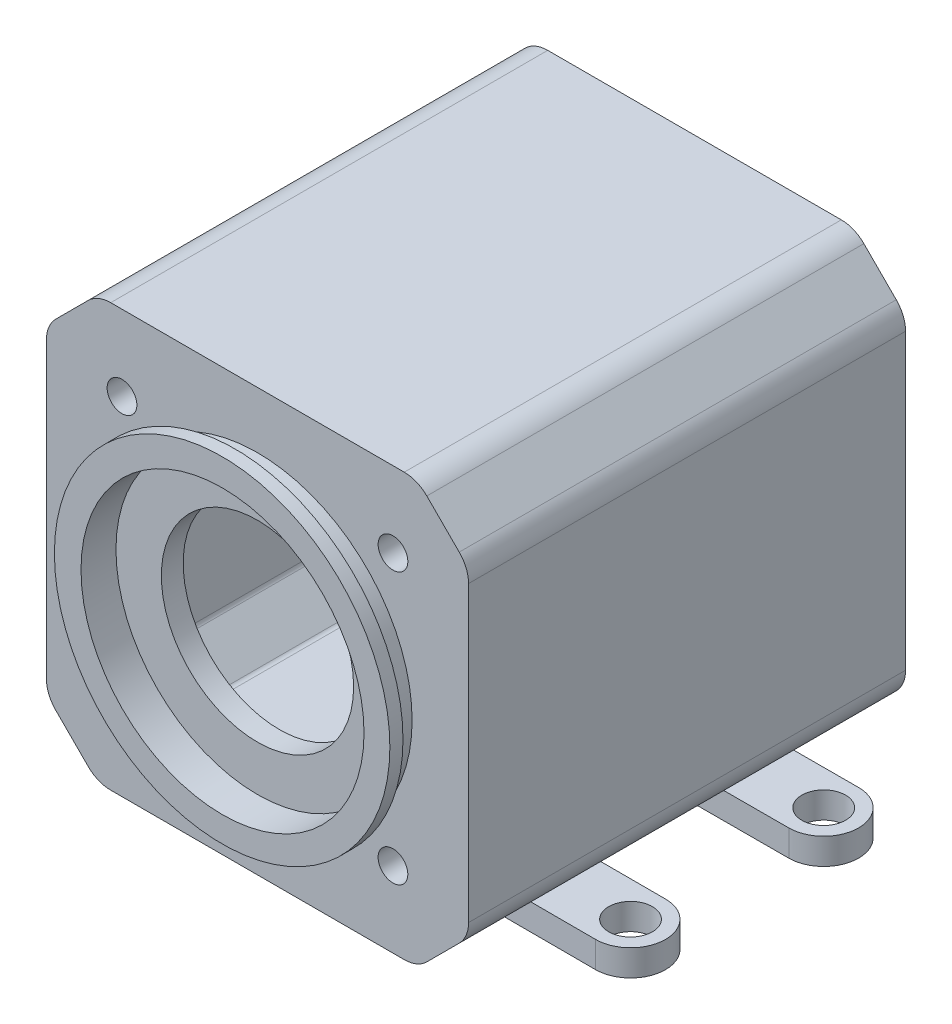
from build123d import *

# Parameters (mm, degrees)
SALIENTE_EXTRUIR3_DEPTH = 50
CROQUIS37_3_R           = 1.7
CROQUIS37_3_R_2         = 11
SALIENTE_EXTRUIR4_DEPTH = 2.5
CROQUIS38_R             = 17.69
CROQUIS38_R_2           = 16.19
SALIENTE_EXTRUIR5_DEPTH = 4
SALIENTE_EXTRUIR6_START = -1.5
CROQUIS40_R             = 19.19
CROQUIS40_R_2           = 17.69
SALIENTE_EXTRUIR6_DEPTH = 1.5
CROQUIS41_W             = 18.5
CROQUIS41_H             = 10.5
CORTAR_EXTRUIR1_DEPTH   = 11.5
SALIENTE_EXTRUIR7_DEPTH = 3
CROQUIS44_R             = 2.5
CORTAR_EXTRUIR2_DEPTH   = 3


with BuildPart() as part:
    # Croquis37 → Saliente-Extruir3 (new body)
    with BuildSketch(Plane.XY):
        with BuildLine():
            Line((-24.106917755, 16.707259035), (-24.106917755, -16.878527403))
            ThreePointArc((-24.106917755, -16.878527403), (-23.829078048, -18.275321931), (-23.037857506, -19.459467154))
            Line((-23.037857506, -19.459467154), (-19.330750725, -23.166573935))
            ThreePointArc((-19.330750725, -23.166573935), (-18.146605502, -23.957794478), (-16.749810974, -24.235634184))
            Line((-16.749810974, -24.235634184), (16.835975464, -24.235634184))
            ThreePointArc((16.835975464, -24.235634184), (18.232769992, -23.957794478), (19.416915215, -23.166573935))
            Line((19.416915215, -23.166573935), (23.124021997, -19.459467154))
            ThreePointArc((23.124021997, -19.459467154), (23.915242539, -18.275321931), (24.193082245, -16.878527403))
            Line((24.193082245, -16.878527403), (24.193082245, 16.707259035))
            ThreePointArc((24.193082245, 16.707259035), (23.915242539, 18.104053563), (23.124021997, 19.288198786))
            Line((23.124021997, 19.288198786), (19.416915215, 22.995305567))
            ThreePointArc((19.416915215, 22.995305567), (18.232769992, 23.78652611), (16.835975464, 24.064365816))
            Line((16.835975464, 24.064365816), (-16.749810974, 24.064365816))
            ThreePointArc((-16.749810974, 24.064365816), (-18.146605502, 23.78652611), (-19.330750725, 22.995305567))
            Line((-19.330750725, 22.995305567), (-23.037857506, 19.288198786))
            ThreePointArc((-23.037857506, 19.288198786), (-23.829078048, 18.104053563), (-24.106917755, 16.707259035))
        make_face()
        with BuildLine():
            ThreePointArc((17.295594872, -21.045253592), (17.084719695, -21.18615588), (16.835975464, -21.235634184))
            Line((16.835975464, -21.235634184), (-16.749810974, -21.235634184))
            ThreePointArc((-16.749810974, -21.235634184), (-16.998555205, -21.18615588), (-17.209430381, -21.045253592))
            Line((-17.209430381, -21.045253592), (-20.916537162, -17.338146811))
            ThreePointArc((-20.916537162, -17.338146811), (-21.057439451, -17.127271634), (-21.106917755, -16.878527403))
            Line((-21.106917755, -16.878527403), (-21.106917755, 16.707259035))
            ThreePointArc((-21.106917755, 16.707259035), (-21.057439451, 16.956003266), (-20.916537162, 17.166878443))
            Line((-20.916537162, 17.166878443), (-17.209430381, 20.873985224))
            ThreePointArc((-17.209430381, 20.873985224), (-16.998555205, 21.014887512), (-16.749810974, 21.064365816))
            Line((-16.749810974, 21.064365816), (16.835975464, 21.064365816))
            ThreePointArc((16.835975464, 21.064365816), (17.084719695, 21.014887512), (17.295594872, 20.873985224))
            Line((17.295594872, 20.873985224), (21.002701653, 17.166878443))
            ThreePointArc((21.002701653, 17.166878443), (21.143603941, 16.956003266), (21.193082245, 16.707259035))
            Line((21.193082245, 16.707259035), (21.193082245, -16.878527403))
            ThreePointArc((21.193082245, -16.878527403), (21.143603941, -17.127271634), (21.002701653, -17.338146811))
            Line((21.002701653, -17.338146811), (17.295594872, -21.045253592))
        make_face(mode=Mode.SUBTRACT)
    extrude(amount=-SALIENTE_EXTRUIR3_DEPTH)



with BuildPart() as body_2:
    # Croquis37<3> → Saliente-Extruir4 (new body)
    with BuildSketch(Plane.XY):
        with BuildLine():
            Line((-16.749810974, -21.235634184), (16.835975464, -21.235634184))
            ThreePointArc((16.835975464, -21.235634184), (17.084719695, -21.18615588), (17.295594872, -21.045253592))
            Line((17.295594872, -21.045253592), (21.002701653, -17.338146811))
            ThreePointArc((21.002701653, -17.338146811), (21.143603941, -17.127271634), (21.193082245, -16.878527403))
            Line((21.193082245, -16.878527403), (21.193082245, 16.707259035))
            ThreePointArc((21.193082245, 16.707259035), (21.143603941, 16.956003266), (21.002701653, 17.166878443))
            Line((21.002701653, 17.166878443), (17.295594872, 20.873985224))
            ThreePointArc((17.295594872, 20.873985224), (17.084719695, 21.014887512), (16.835975464, 21.064365816))
            Line((16.835975464, 21.064365816), (-16.749810974, 21.064365816))
            ThreePointArc((-16.749810974, 21.064365816), (-16.998555205, 21.014887512), (-17.209430381, 20.873985224))
            Line((-17.209430381, 20.873985224), (-20.916537162, 17.166878443))
            ThreePointArc((-20.916537162, 17.166878443), (-21.057439451, 16.956003266), (-21.106917755, 16.707259035))
            Line((-21.106917755, 16.707259035), (-21.106917755, -16.878527403))
            ThreePointArc((-21.106917755, -16.878527403), (-21.057439451, -17.127271634), (-20.916537162, -17.338146811))
            Line((-20.916537162, -17.338146811), (-17.209430381, -21.045253592))
            ThreePointArc((-17.209430381, -21.045253592), (-16.998555205, -21.18615588), (-16.749810974, -21.235634184))
        make_face()
        with Locations((-15.456917755, -15.585634184)):
            Circle(CROQUIS37_3_R, mode=Mode.SUBTRACT)
        with Locations((15.543082245, -15.585634184)):
            Circle(CROQUIS37_3_R, mode=Mode.SUBTRACT)
        with Locations((-15.456917755, 15.414365816)):
            Circle(CROQUIS37_3_R, mode=Mode.SUBTRACT)
        with Locations((0.043082245, -0.085634184)):
            Circle(CROQUIS37_3_R_2, mode=Mode.SUBTRACT)
        with Locations((15.543082245, 15.414365816)):
            Circle(CROQUIS37_3_R, mode=Mode.SUBTRACT)
    extrude(amount=-SALIENTE_EXTRUIR4_DEPTH)


with BuildPart() as part_1:
    add(part.part)

    add(body_2.part)  # Saliente-Extruir5 merges body 2
    # Croquis38 → Saliente-Extruir5 (add)
    with BuildSketch(Plane.XY):
        with Locations((0.043082245, -0.085634184)):
            Circle(CROQUIS38_R)
        with Locations((0.043082245, -0.085634184)):
            Circle(CROQUIS38_R_2, mode=Mode.SUBTRACT)
    extrude(amount=SALIENTE_EXTRUIR5_DEPTH)

    # Croquis40 → Saliente-Extruir6 (add)
    with BuildSketch(Plane.XY.offset(4).offset(SALIENTE_EXTRUIR6_START)):
        Circle(CROQUIS40_R)
        with Locations((0.043082245, -0.085634184)):
            Circle(CROQUIS40_R_2, mode=Mode.SUBTRACT)
    extrude(amount=SALIENTE_EXTRUIR6_DEPTH)

    # Croquis41 → Cortar-Extruir1 (cut)
    with BuildSketch(Plane.XZ.offset(24.235634184)):
        with Locations((0.045189026, -44.75)):
            Rectangle(CROQUIS41_W, CROQUIS41_H)
    extrude(amount=-CORTAR_EXTRUIR1_DEPTH, mode=Mode.SUBTRACT)

    # Croquis42 → Saliente-Extruir7 (add)
    with BuildSketch(Plane.XZ.offset(24.235634184)):
        with BuildLine():
            Line((-16.749810974, -10), (-28.749810974, -10))
            ThreePointArc((-28.749810974, -10), (-32.749810974, -14), (-28.749810974, -18))
            Line((-28.749810974, -18), (-16.749810974, -18))
            Line((-16.749810974, -18), (-16.749810974, -10))
        make_face()
        with BuildLine():
            Line((16.767018988, -9.971120394), (16.780805296, -17.971108515))
            Line((16.780805296, -17.971108515), (28.780787478, -17.950429053))
            ThreePointArc((28.780787478, -17.950429053), (32.773888384, -13.943541838), (28.767001169, -9.950440932))
            Line((28.767001169, -9.950440932), (16.767018988, -9.971120394))
        make_face()
        with BuildLine():
            Line((-16.749810974, -40), (-28.749810974, -40))
            ThreePointArc((-28.749810974, -40), (-32.749810974, -36), (-28.749810974, -32))
            Line((-28.749810974, -32), (-16.749810974, -32))
            Line((-16.749810974, -32), (-16.749810974, -40))
        make_face()
        with BuildLine():
            Line((16.767018988, -40.028879606), (16.780805296, -32.028891485))
            Line((16.780805296, -32.028891485), (28.780787478, -32.049570947))
            ThreePointArc((28.780787478, -32.049570947), (32.773888384, -36.056458162), (28.767001169, -40.049559068))
            Line((28.767001169, -40.049559068), (16.767018988, -40.028879606))
        make_face()
    extrude(amount=-SALIENTE_EXTRUIR7_DEPTH)

    # Croquis44 → Cortar-Extruir2 (cut)
    with BuildSketch(Plane(origin=(0, -21.235634184, 0), x_dir=(1, 0, 0), z_dir=(0, 1, 0))):
        with Locations((-28.749810974, 36)):
            Circle(CROQUIS44_R)
        with Locations((28.773894323, 36.049565008)):
            Circle(CROQUIS44_R)
        with Locations((28.773894323, 13.950434992)):
            Circle(CROQUIS44_R)
        with Locations((-28.749810974, 14)):
            Circle(CROQUIS44_R)
    extrude(amount=-CORTAR_EXTRUIR2_DEPTH, mode=Mode.SUBTRACT)


solid = part_1.part
